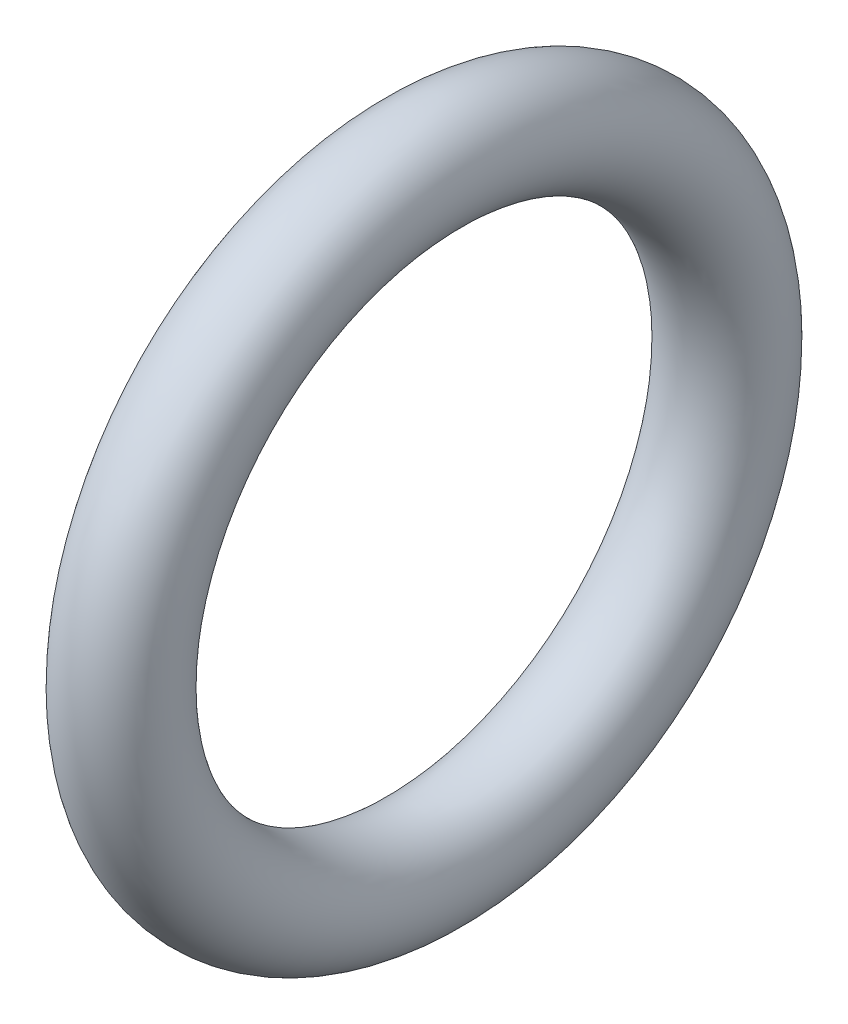
from build123d import *

# Parameters (mm, degrees)
SKETCH4_R = 0.95


with BuildPart() as part:
    # Sketch4 → Revolve1 (revolve)
    with BuildSketch(Plane.XY, mode=Mode.PRIVATE) as revolve1_sk:
        with Locations((0, 5.425)):
            Circle(SKETCH4_R)
    revolve(revolve1_sk.sketch.rotate(Axis((0, 0, 0), (1, 0, 0)), 90), axis=Axis((0, 0, 0), (1, 0, 0)))


solid = part.part
